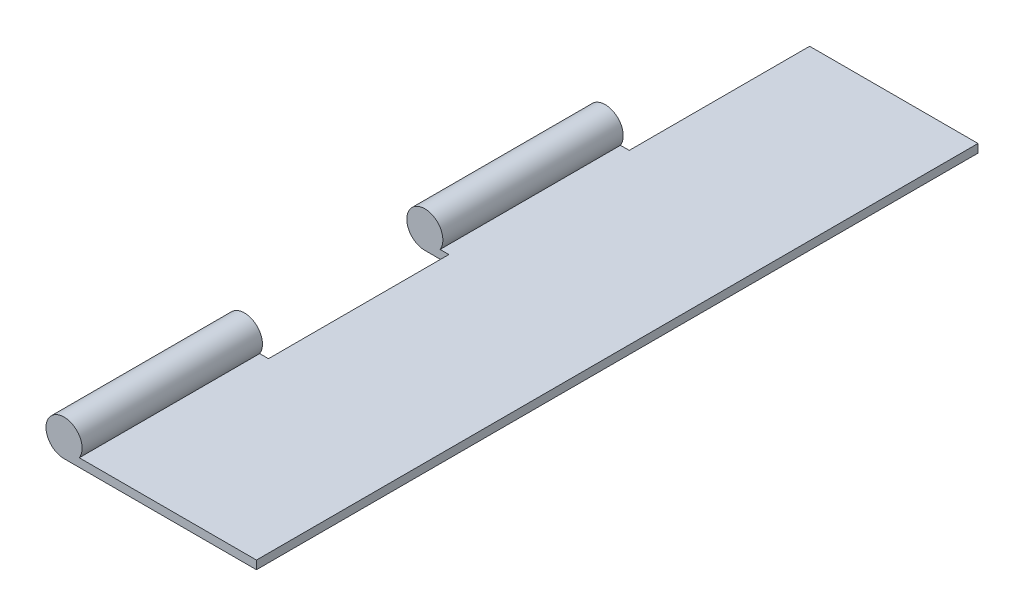
from build123d import *

# Parameters (mm, degrees)
EXTRUSION1_DEPTH           = 60
EXTRUSION2_START           = -10
ESQUISSE2_W                = 7.046962448
ESQUISSE2_H                = 15
EXTRUSION2_DEPTH           = 73.139279043
R_P_TITION_LIN_AIRE1_COUNT = 2
R_P_TITION_LIN_AIRE1_PITCH = 30


with BuildPart() as part:
    # Esquisse1 → Extrusion1 (new body)
    with BuildSketch(Plane.XY):
        with BuildLine():
            Line((0, 0), (16, 0))
            Line((16, 0), (16, 0.7))
            Line((16, 0.7), (1.268857754, 0.7))
            ThreePointArc((1.268857754, 0.7), (-0.724568837, 2.813392554), (0, 0))
        make_face()
    extrude(amount=EXTRUSION1_DEPTH)

    # Esquisse2 → Extrusion2 (cut, through all)
    with BuildSketch(Plane(origin=(0, 0.7, 0), x_dir=(1, 0, 0), z_dir=(0, 1, 0)).offset(EXTRUSION2_START)):
        with Locations((-1.523481224, -37.5)):
            Rectangle(ESQUISSE2_W, ESQUISSE2_H)
    extrusion2 = extrude(amount=EXTRUSION2_DEPTH, mode=Mode.SUBTRACT)

    # Répétition linéaire1: Extrusion2 ×2
    with Locations(*[(0, 0, -i * R_P_TITION_LIN_AIRE1_PITCH) for i in range(1, R_P_TITION_LIN_AIRE1_COUNT)]):
        add(extrusion2, mode=Mode.SUBTRACT)


solid = part.part
